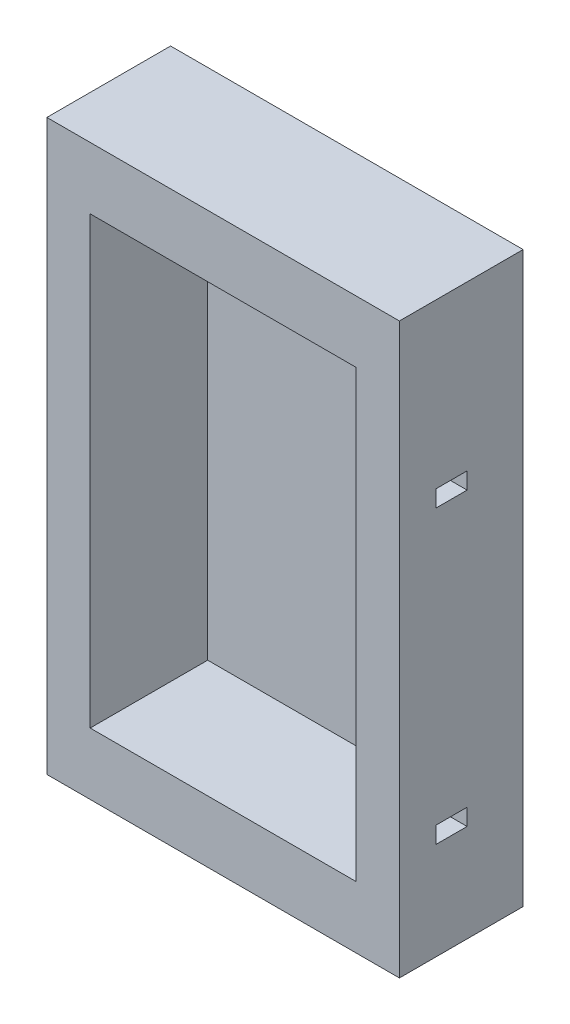
from build123d import *

# Parameters (mm, degrees)
SKETCH1_W           = 144.78
SKETCH1_H           = 233.68
BOSS_EXTRUDE1_DEPTH = 50.8
SKETCH2_W           = 109.22
SKETCH2_H           = 182.88
CUT_EXTRUDE1_DEPTH  = 48.26
CUT_EXTRUDE3_REACH  = 194.856
SKETCH6_W           = 12.7
SKETCH6_H           = 6.85


with BuildPart() as part:
    # Sketch1 → Boss-Extrude1 (new body)
    with BuildSketch(Plane.XY):
        Rectangle(SKETCH1_W, SKETCH1_H)
    extrude(amount=BOSS_EXTRUDE1_DEPTH)

    # Sketch2 → Cut-Extrude1 (cut)
    with BuildSketch(Plane.XY.offset(50.8)):
        Rectangle(SKETCH2_W, SKETCH2_H)
    extrude(amount=-CUT_EXTRUDE1_DEPTH, mode=Mode.SUBTRACT)

    # Sketch6 → Cut-Extrude3 (cut, up to next)
    with BuildSketch(Plane(origin=(72.39, 0, 0), x_dir=(0, 0, -1), z_dir=(1, 0, 0)), mode=Mode.PRIVATE) as cut_extrude3_sk1:
        with Locations((-29.35, 46.215)):
            Rectangle(SKETCH6_W, SKETCH6_H)
    cut_extrude3_tool1 = extrude(cut_extrude3_sk1.sketch, amount=-CUT_EXTRUDE3_REACH, mode=Mode.PRIVATE) & part.part
    # Sketch6 → Cut-Extrude3 (cut, up to next)
    with BuildSketch(Plane(origin=(72.39, 0, 0), x_dir=(0, 0, -1), z_dir=(1, 0, 0)), mode=Mode.PRIVATE) as cut_extrude3_sk2:
        with Locations((-29.35, -73.415)):
            Rectangle(SKETCH6_W, SKETCH6_H)
    cut_extrude3_tool2 = extrude(cut_extrude3_sk2.sketch, amount=-CUT_EXTRUDE3_REACH, mode=Mode.PRIVATE) & part.part
    add(cut_extrude3_tool1.solids().sort_by_distance((72.39, 46.215, 29.35))[0], mode=Mode.SUBTRACT)
    add(cut_extrude3_tool2.solids().sort_by_distance((72.39, -73.415, 29.35))[0], mode=Mode.SUBTRACT)


solid = part.part
